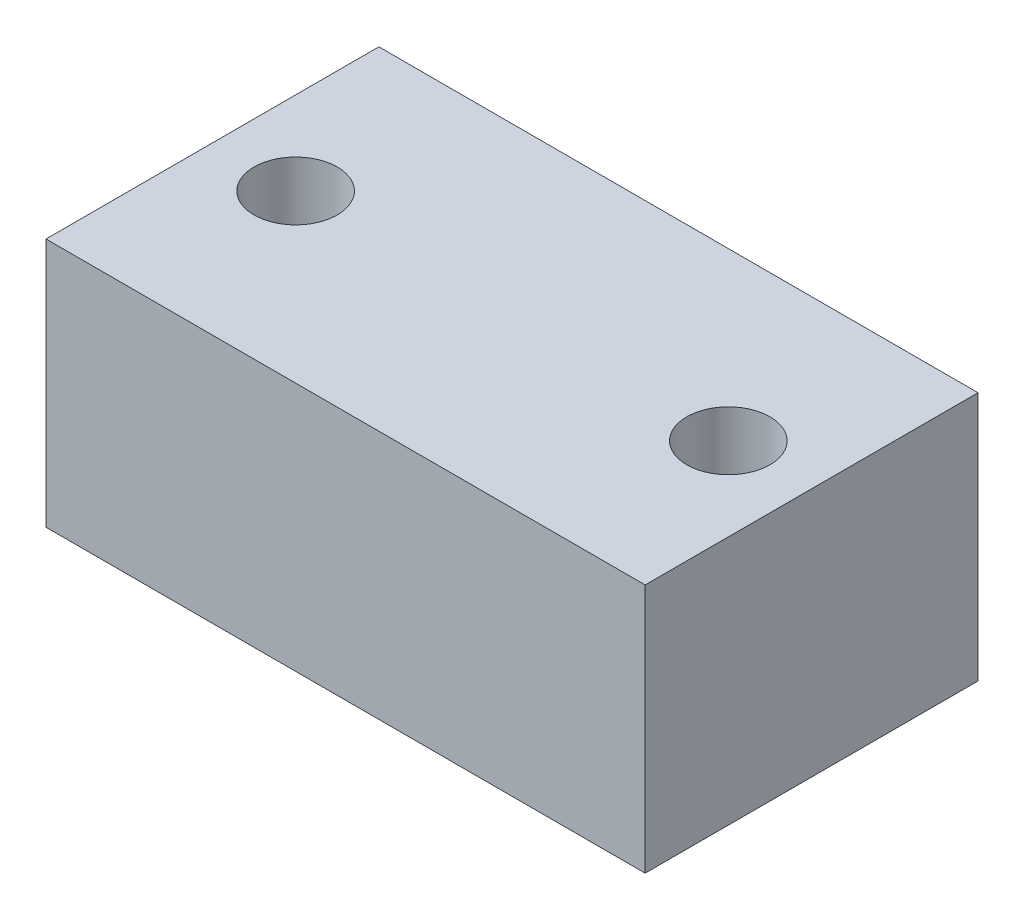
from build123d import *

# Parameters (mm, degrees)
SKETCH1_W           = 36
SKETCH1_H           = 20
BOSS_EXTRUDE1_DEPTH = 15
SKETCH4_R           = 2.5
CUT_EXTRUDE1_DEPTH  = 10


with BuildPart() as part:
    # Sketch1 → Boss-Extrude1 (new body)
    with BuildSketch(Plane(origin=(0, 0, 0), x_dir=(1, 0, 0), z_dir=(0, 1, 0))):
        Rectangle(SKETCH1_W, SKETCH1_H)
    extrude(amount=BOSS_EXTRUDE1_DEPTH)

    # Sketch4 → Cut-Extrude1 (cut)
    with BuildSketch(Plane(origin=(0, 15, 0), x_dir=(1, 0, 0), z_dir=(0, 1, 0))):
        with Locations(Location((13, 0, 0), (0, 0, 270))):
            Circle(SKETCH4_R)
        with Locations(Location((-13, 0, 0), (0, 0, 90))):
            Circle(SKETCH4_R)
    extrude(amount=-CUT_EXTRUDE1_DEPTH, mode=Mode.SUBTRACT)


solid = part.part
